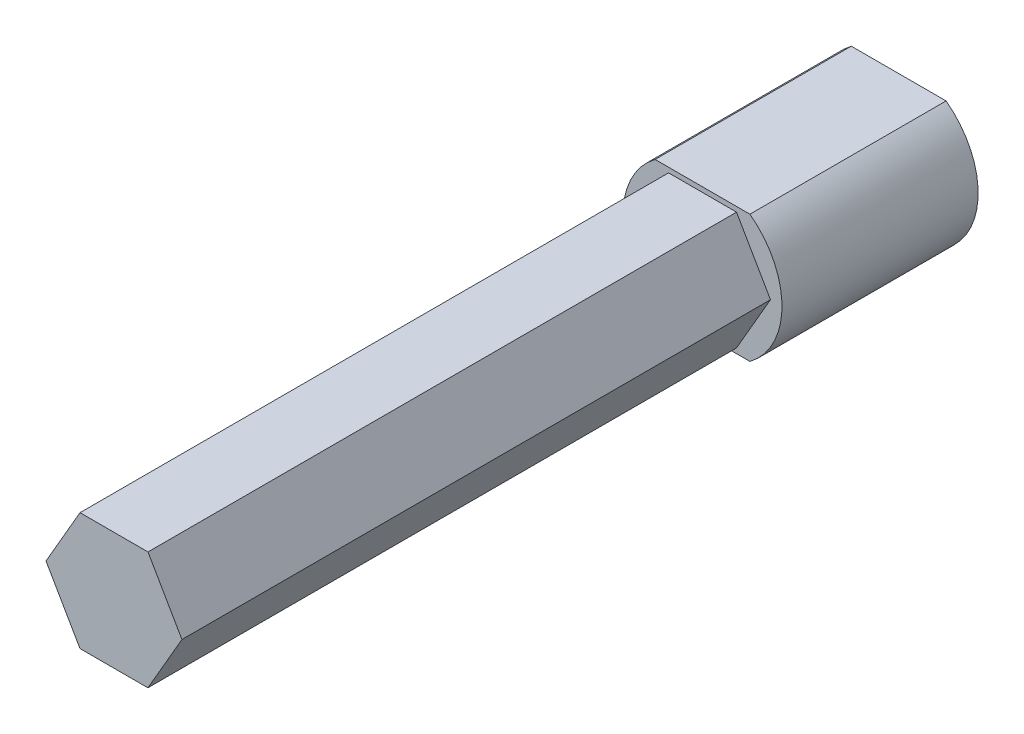
from build123d import *

# Parameters (mm, degrees)
BOSS_EXTRUDE2_DEPTH = 10
BOSS_EXTRUDE3_DEPTH = 30
CUT_EXTRUDE1_DEPTH  = 5


with BuildPart() as part:
    # Sketch1 → Boss-Extrude2 (new body)
    with BuildSketch(Plane.XY):
        with BuildLine():
            Line((-2.416609195, 3.25), (2.416609195, 3.25))
            ThreePointArc((2.416609195, 3.25), (4.05, 0), (2.416609195, -3.25))
            Line((2.416609195, -3.25), (-2.416609195, -3.25))
            ThreePointArc((-2.416609195, -3.25), (-4.05, 0), (-2.416609195, 3.25))
        make_face()
    extrude(amount=BOSS_EXTRUDE2_DEPTH)

    # Sketch4 → Boss-Extrude3 (add)
    with BuildSketch(Plane.XY.offset(10)):
        Polygon((1.730250139, -3.001038896), (3.464100991, -0.002078873), (1.733850853, 2.998960023), (-1.730250139, 3.001038896), (-3.464100991, 0.002078873), (-1.733850853, -2.998960023), align=None)
    extrude(amount=BOSS_EXTRUDE3_DEPTH)

    # Sketch3 → Cut-Extrude1 (cut)
    with BuildSketch(Plane(origin=(0, 0, 0), x_dir=(-1, 0, 0), z_dir=(0, 0, -1))):
        with BuildLine():
            Line((2.19089023, 2.6), (-2.19089023, 2.6))
            ThreePointArc((-2.19089023, 2.6), (-3.4, 0), (-2.19089023, -2.6))
            Line((-2.19089023, -2.6), (2.19089023, -2.6))
            ThreePointArc((2.19089023, -2.6), (3.4, 0), (2.19089023, 2.6))
        make_face()
    extrude(amount=-CUT_EXTRUDE1_DEPTH, mode=Mode.SUBTRACT)


solid = part.part
